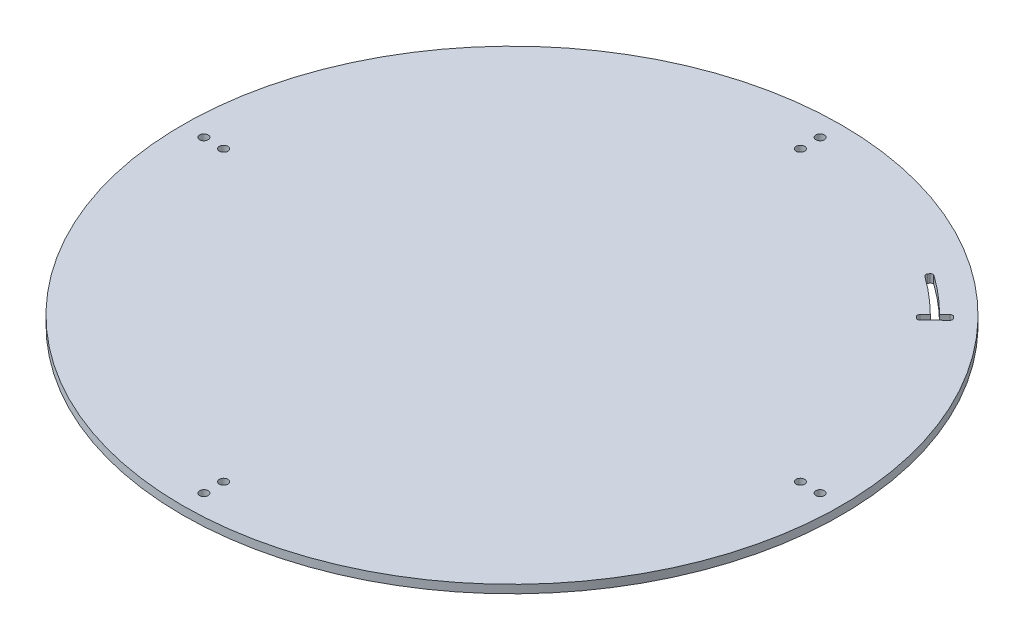
from build123d import *

# Parameters (mm, degrees)
SKETCH_1_R                    = 200
EXTRUDE_251_DEPTH             = 5
CUT_EXTRUDE_3_REACH           = 284.887
SKETCH_2_R                    = 2.6
PATTERN_CIRCULAR_1_COUNT      = 4
SKETCH_4_W                    = 4
SKETCH_4_H                    = 11.5
CUT_REVOLVE_3_ANGLE           = 9.5
CUT_REVOLVE_3_OTHER_WAY_ANGLE = 0.5
FILLET_2_R                    = 1.5
CUT_EXTRUDE_1690_REACH        = 284.887
FILLET_1_R                    = 1.5


with BuildPart() as part:
    # 草图1 → Extrude 251 (new body)
    with BuildSketch(Plane(origin=(0, 0, 0), x_dir=(1, 0, 0), z_dir=(0, 1, 0))):
        Circle(SKETCH_1_R)
    extrude(amount=EXTRUDE_251_DEPTH)

    # 草图2 → 切除-拉伸3 (cut, up to next)
    with BuildSketch(Plane(origin=(0, 5, 0), x_dir=(1, 0, 0), z_dir=(0, 1, 0)), mode=Mode.PRIVATE) as cut_extrude_3_sk1:
        with Locations((0, -175)):
            Circle(SKETCH_2_R)
    cut_extrude_3_tool1 = extrude(cut_extrude_3_sk1.sketch, amount=-CUT_EXTRUDE_3_REACH, mode=Mode.PRIVATE) & part.part
    # 草图2 → 切除-拉伸3 (cut, up to next)
    with BuildSketch(Plane(origin=(0, 5, 0), x_dir=(1, 0, 0), z_dir=(0, 1, 0)), mode=Mode.PRIVATE) as cut_extrude_3_sk2:
        with Locations((0, -187)):
            Circle(SKETCH_2_R)
    cut_extrude_3_tool2 = extrude(cut_extrude_3_sk2.sketch, amount=-CUT_EXTRUDE_3_REACH, mode=Mode.PRIVATE) & part.part
    cut_extrude_3_1 = cut_extrude_3_tool1.solids().sort_by_distance((0, 5, 175))[0]
    add(cut_extrude_3_1, mode=Mode.SUBTRACT)
    cut_extrude_3_2 = cut_extrude_3_tool2.solids().sort_by_distance((0, 5, 187))[0]
    add(cut_extrude_3_2, mode=Mode.SUBTRACT)
    cut_extrude_3 = cut_extrude_3_1 + cut_extrude_3_2  # 切除-拉伸3 as one shape, for the pattern or mirror that repeats it

    # 阵列(圆周)1: 切除-拉伸3 ×4 about axis
    pattern_circular_1_axis = Axis((0, -55, 0), (0, 1, 0))
    for i in range(1, PATTERN_CIRCULAR_1_COUNT):
        add(cut_extrude_3.rotate(pattern_circular_1_axis, i * 360 / PATTERN_CIRCULAR_1_COUNT), mode=Mode.SUBTRACT)

    # 草图4 → 切除-旋转3 (revolve, cut)
    with BuildSketch(Plane(origin=(0, 0, 0), x_dir=(0.7036657529829018, 0, -0.710531145045033), z_dir=(0.710531145045033, 0, 0.7036657529829018))):
        with Locations((181.5, 5.25)):
            Rectangle(SKETCH_4_W, SKETCH_4_H)
    revolve(axis=Axis((0, -55, 0), (0, 1, 0)), revolution_arc=CUT_REVOLVE_3_ANGLE, mode=Mode.SUBTRACT)

    # 草图4 → 切除-旋转3 other way (revolve, cut)
    with BuildSketch(Plane(origin=(0, 0, 0), x_dir=(0.7036657529829018, 0, -0.710531145045033), z_dir=(0.710531145045033, 0, 0.7036657529829018))):
        with Locations((181.5, 5.25)):
            Rectangle(SKETCH_4_W, SKETCH_4_H)
    revolve(axis=Axis((0, -55, 0), (0, -1, 0)), revolution_arc=CUT_REVOLVE_3_OTHER_WAY_ANGLE, mode=Mode.SUBTRACT)

    # 圆角2
    fillet_2_edges = [part.edges().sort_by_distance(p)[0] for p in [
        (103.525536527, 2.5, -146.638034926),
        (105.832512271, 2.5, -149.905734868),
    ]]
    fillet(fillet_2_edges, radius=FILLET_2_R)

    # 草图6 → Cut-Extrude 1690 (cut, up to next)
    with BuildSketch(Plane(origin=(0, 5, 0), x_dir=(1, 0, 0), z_dir=(0, 1, 0)), mode=Mode.PRIVATE) as cut_extrude_1690_sk1:
        with BuildLine():
            Line((122.328963701, 123.036070482), (133.642715214, 134.349821995))
            ThreePointArc((133.642715214, 134.349821995), (135.160960115, 132.822305585), (136.66174685, 131.277633083))
            Line((136.66174685, 131.277633083), (125.152266287, 120.163056899))
            ThreePointArc((125.152266287, 120.163056899), (123.748952928, 121.607757356), (122.328963701, 123.036070482))
        make_face()
    cut_extrude_1690_tool1 = extrude(cut_extrude_1690_sk1.sketch, amount=-CUT_EXTRUDE_1690_REACH, mode=Mode.PRIVATE) & part.part
    add(cut_extrude_1690_tool1.solids().sort_by_distance((129.515831, 5, -127.274853))[0], mode=Mode.SUBTRACT)

    # 圆角1
    fillet_1_edges = [part.edges().sort_by_distance(p)[0] for p in [
        (125.152266287, 2.5, -120.163056899),
        (136.66174685, 2.5, -131.277633083),
        (133.642715214, 2.5, -134.349821995),
        (122.328963701, 2.5, -123.036070482),
    ]]
    fillet(fillet_1_edges, radius=FILLET_1_R)


solid = part.part
